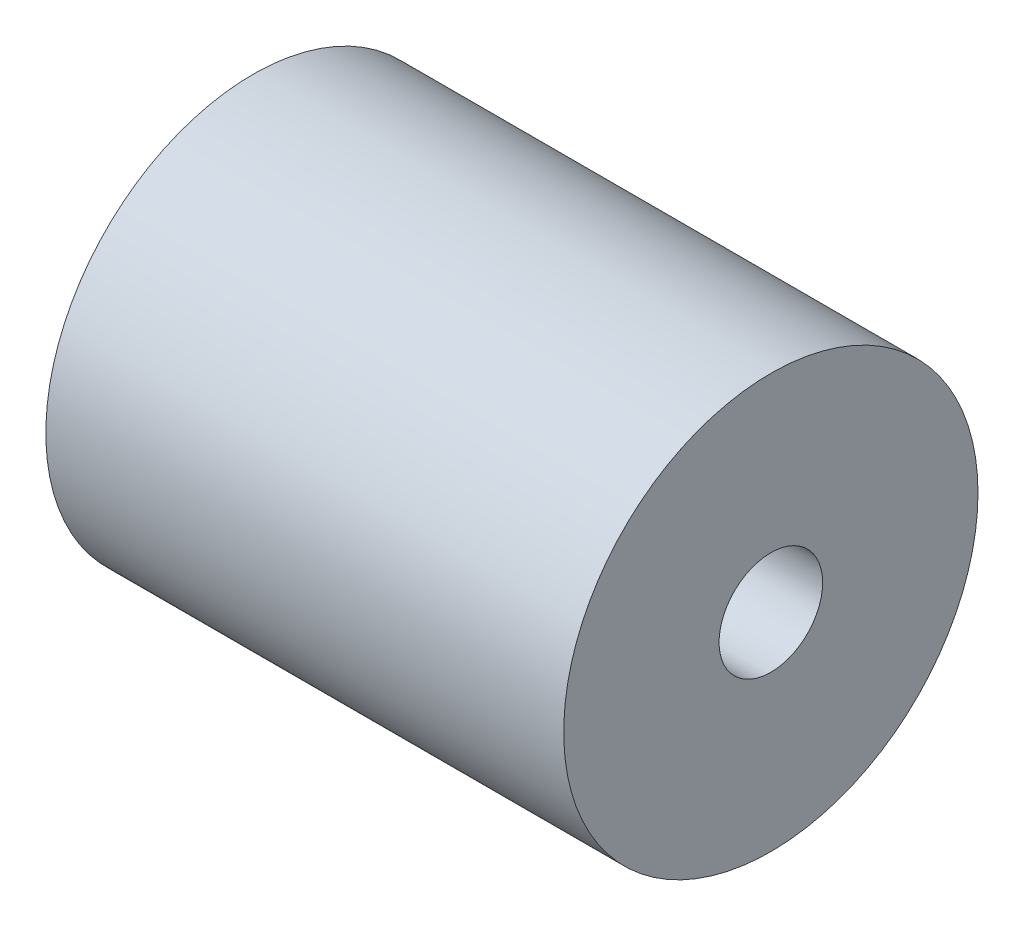
from build123d import *

# Parameters (mm, degrees)
SKETCH1_R           = 10
BOSS_EXTRUDE1_DEPTH = 12.5
SKETCH2_R           = 4
CUT_EXTRUDE1_DEPTH  = 19.874586088
SKETCH3_R           = 2.5
CUT_EXTRUDE2_DEPTH  = 19.874586088


with BuildPart() as part:
    # Sketch1 → Boss-Extrude1 (new, symmetric)
    with BuildSketch(Plane(origin=(0, 0, 0), x_dir=(0, 0, -1), z_dir=(1, 0, 0))):
        Circle(SKETCH1_R)
    extrude(amount=BOSS_EXTRUDE1_DEPTH, both=True)

    # Sketch2 → Cut-Extrude1 (cut, through all)
    with BuildSketch(Plane(origin=(0, 0, 0), x_dir=(0, 0, -1), z_dir=(1, 0, 0))):
        Circle(SKETCH2_R)
    extrude(amount=-CUT_EXTRUDE1_DEPTH, mode=Mode.SUBTRACT)

    # Sketch3 → Cut-Extrude2 (cut, through all)
    with BuildSketch(Plane(origin=(0, 0, 0), x_dir=(0, 0, -1), z_dir=(1, 0, 0))):
        Circle(SKETCH3_R)
    extrude(amount=CUT_EXTRUDE2_DEPTH, mode=Mode.SUBTRACT)


solid = part.part
